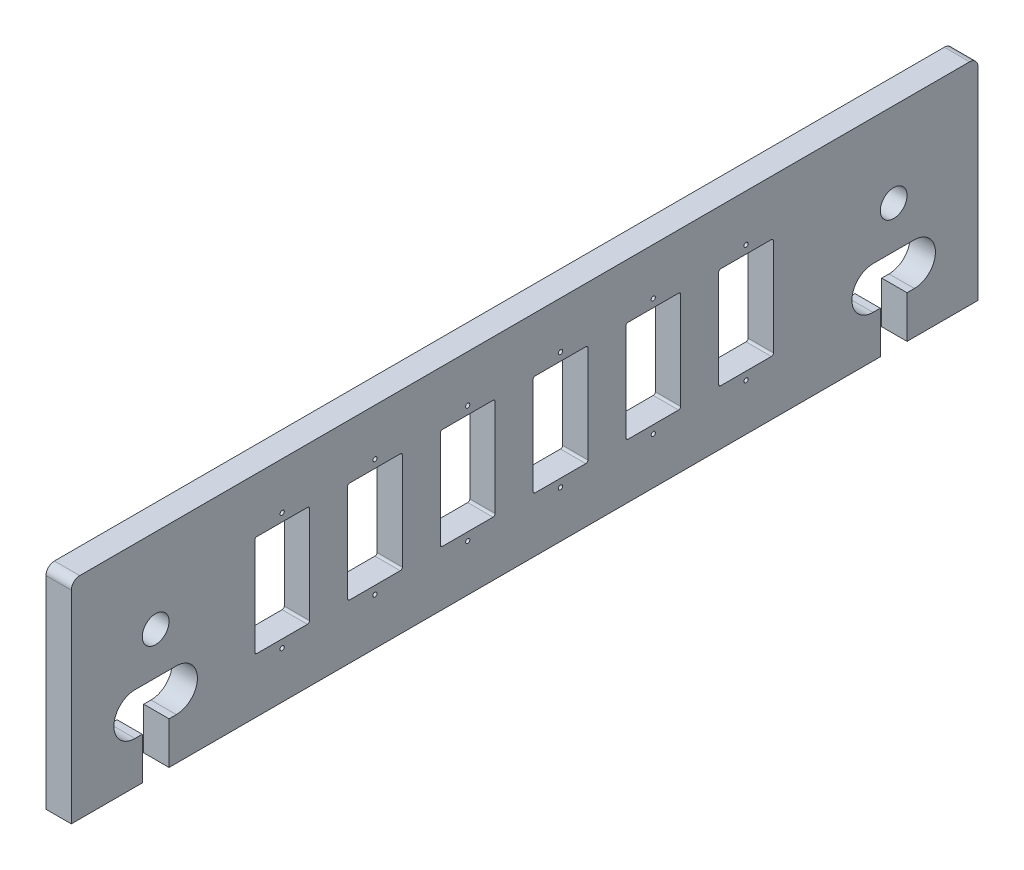
from build123d import *

# Parameters (mm, degrees)
SKETCH1_R           = 3.175
BOSS_EXTRUDE1_DEPTH = 6
SERVO_MOUNT_REACH   = 203.398
SKETCH2_R           = 0.5
LPATTERN1_COUNT     = 6
LPATTERN1_PITCH     = 22


with BuildPart() as part:
    # Sketch1 → Boss-Extrude1 (new body)
    with BuildSketch(Plane(origin=(0, 0, 0), x_dir=(0, 0, -1), z_dir=(1, 0, 0))):
        with BuildLine():
            Line((-3.175, 0), (-20, 0))
            Line((-20, 0), (-20, 48))
            ThreePointArc((-20, 48), (-19.414213562, 49.414213562), (-18, 50))
            Line((-18, 50), (193, 50))
            ThreePointArc((193, 50), (194.414213562, 49.414213562), (195, 48))
            Line((195, 48), (195, 0))
            Line((195, 0), (178.175, 0))
            Line((178.175, 0), (178.175, 10))
            Line((178.175, 10), (179.9, 10))
            ThreePointArc((179.9, 10), (184.9, 15), (179.9, 20))
            Line((179.9, 20), (170.1, 20))
            ThreePointArc((170.1, 20), (165.1, 15), (170.1, 10))
            Line((170.1, 10), (171.825, 10))
            Line((171.825, 10), (171.825, 0))
            Line((171.825, 0), (3.175, 0))
            Line((3.175, 0), (3.175, 10))
            Line((3.175, 10), (4.9, 10))
            ThreePointArc((4.9, 10), (9.9, 15), (4.9, 20))
            Line((4.9, 20), (-4.9, 20))
            ThreePointArc((-4.9, 20), (-9.9, 15), (-4.9, 10))
            Line((-4.9, 10), (-3.175, 10))
            Line((-3.175, 10), (-3.175, 0))
        make_face()
        with Locations(Location((175, 30, 0), (0, 0, 180))):
            Circle(SKETCH1_R, mode=Mode.SUBTRACT)
        with Locations((0, 30)):
            Circle(SKETCH1_R, mode=Mode.SUBTRACT)
    extrude(amount=BOSS_EXTRUDE1_DEPTH)

    # Sketch2 → servo mount (cut, up to next)
    with BuildSketch(Plane(origin=(6, 0, 0), x_dir=(0, 0, -1), z_dir=(1, 0, 0)), mode=Mode.PRIVATE) as servo_mount_sk1:
        with Locations((30, 38.9)):
            Circle(SKETCH2_R)
    servo_mount_tool1 = extrude(servo_mount_sk1.sketch, amount=-SERVO_MOUNT_REACH, mode=Mode.PRIVATE) & part.part
    # Sketch2 → servo mount (cut, up to next)
    with BuildSketch(Plane(origin=(6, 0, 0), x_dir=(0, 0, -1), z_dir=(1, 0, 0)), mode=Mode.PRIVATE) as servo_mount_sk2:
        with Locations((30, 11.1)):
            Circle(SKETCH2_R)
    servo_mount_tool2 = extrude(servo_mount_sk2.sketch, amount=-SERVO_MOUNT_REACH, mode=Mode.PRIVATE) & part.part
    # Sketch2 → servo mount (cut, up to next)
    with BuildSketch(Plane(origin=(6, 0, 0), x_dir=(0, 0, -1), z_dir=(1, 0, 0)), mode=Mode.PRIVATE) as servo_mount_sk3:
        with BuildLine():
            Line((24, 13), (36, 13))
            ThreePointArc((36, 13), (36.353553391, 13.146446609), (36.5, 13.5))
            Line((36.5, 13.5), (36.5, 36.5))
            ThreePointArc((36.5, 36.5), (36.353553391, 36.853553391), (36, 37))
            Line((36, 37), (24, 37))
            ThreePointArc((24, 37), (23.646446609, 36.853553391), (23.5, 36.5))
            Line((23.5, 36.5), (23.5, 13.5))
            ThreePointArc((23.5, 13.5), (23.646446609, 13.146446609), (24, 13))
        make_face()
    servo_mount_tool3 = extrude(servo_mount_sk3.sketch, amount=-SERVO_MOUNT_REACH, mode=Mode.PRIVATE) & part.part
    servo_mount_1 = servo_mount_tool1.solids().sort_by_distance((6, 38.9, -30))[0]
    add(servo_mount_1, mode=Mode.SUBTRACT)
    servo_mount_2 = servo_mount_tool2.solids().sort_by_distance((6, 11.1, -30))[0]
    add(servo_mount_2, mode=Mode.SUBTRACT)
    servo_mount_3 = servo_mount_tool3.solids().sort_by_distance((6, 25, -30))[0]
    add(servo_mount_3, mode=Mode.SUBTRACT)
    servo_mount = servo_mount_1 + servo_mount_2 + servo_mount_3  # servo mount as one shape, for the pattern or mirror that repeats it

    # LPattern1: servo mount ×6
    with Locations(*[(0, 0, -i * LPATTERN1_PITCH) for i in range(1, LPATTERN1_COUNT)]):
        add(servo_mount, mode=Mode.SUBTRACT)


solid = part.part
